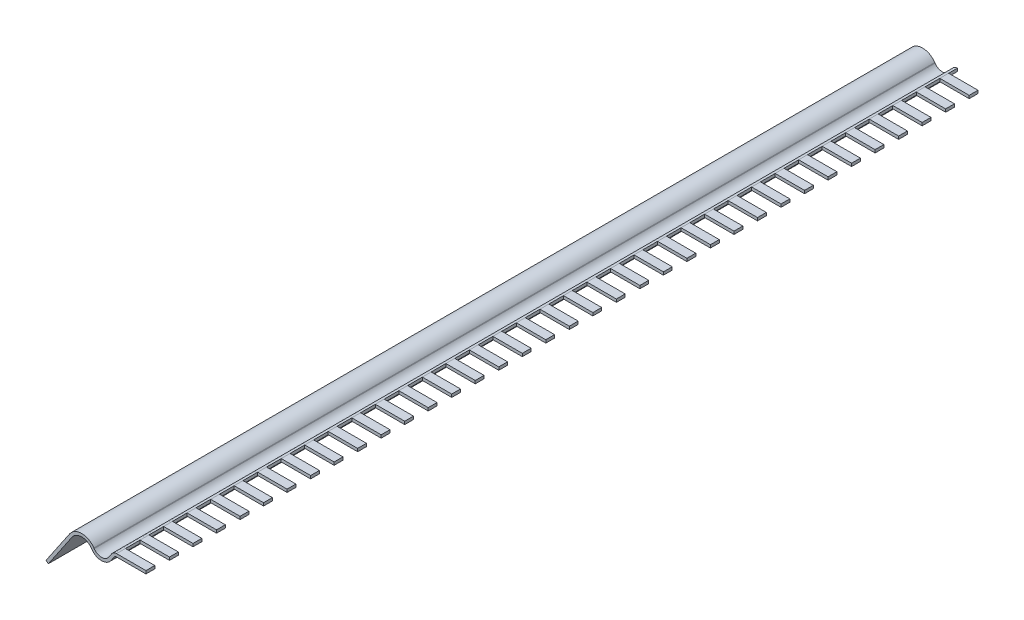
from build123d import *

# Parameters (mm, degrees)
BOSS_EXTRUDE1_DEPTH = 71.5
SKETCH3_W           = 5
SKETCH3_H           = 2.5
CUT_EXTRUDE1_DEPTH  = 74.85295489
LPATTERN1_COUNT     = 36
LPATTERN1_PITCH     = 4


with BuildPart() as part:
    # Sketch1 → Boss-Extrude1 (new, symmetric)
    with BuildSketch(Plane.XY):
        with BuildLine():
            Line((0, 0), (-5, 0))
            ThreePointArc((-5, 0), (-5.468268863, -0.11641397), (-5.827511651, -0.438551456))
            Line((-5.827511651, -0.438551456), (-6.324130952, -1.170512135))
            ThreePointArc((-6.324130952, -1.170512135), (-7.565398428, -1.828339319), (-8.806665905, -1.170512135))
            Line((-8.806665905, -1.170512135), (-8.856963859, -1.096378639))
            ThreePointArc((-8.856963859, -1.096378639), (-10.925742986, 0), (-12.994522113, -1.096378639))
            Line((-12.994522113, -1.096378639), (-17, -7))
            Line((-17, -7), (-16.586244175, -7.280724272))
            Line((-16.586244175, -7.280724272), (-12.580766288, -1.377102912))
            ThreePointArc((-12.580766288, -1.377102912), (-10.925742986, -0.5), (-9.270719684, -1.377102912))
            Line((-9.270719684, -1.377102912), (-9.22042173, -1.451236407))
            ThreePointArc((-9.22042173, -1.451236407), (-7.565398428, -2.328339319), (-5.910375127, -1.451236407))
            Line((-5.910375127, -1.451236407), (-5.413755825, -0.719275728))
            ThreePointArc((-5.413755825, -0.719275728), (-5.234134431, -0.558206985), (-5, -0.5))
            Line((-5, -0.5), (0, -0.5))
            Line((0, -0.5), (0, 0))
        make_face()
    extrude(amount=BOSS_EXTRUDE1_DEPTH, both=True)

    # Sketch3 → Cut-Extrude1 (cut, through all)
    with BuildSketch(Plane(origin=(0, 0, 0), x_dir=(1, 0, 0), z_dir=(0, 1, 0))):
        with Locations((-2.5, -68.75)):
            Rectangle(SKETCH3_W, SKETCH3_H)
    cut_extrude1 = extrude(amount=-CUT_EXTRUDE1_DEPTH, mode=Mode.SUBTRACT)

    # LPattern1: Cut-Extrude1 ×36
    with Locations(*[(0, 0, -i * LPATTERN1_PITCH) for i in range(1, LPATTERN1_COUNT)]):
        add(cut_extrude1, mode=Mode.SUBTRACT)


solid = part.part
